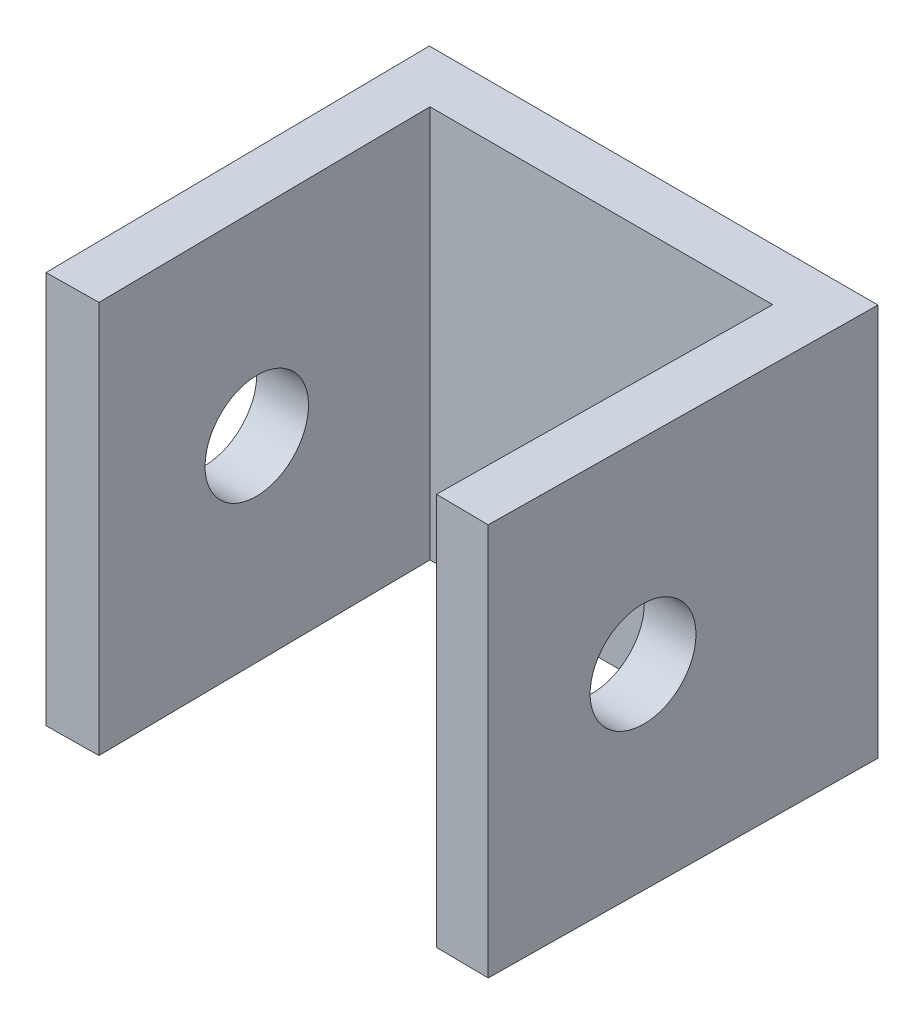
from build123d import *

# Parameters (mm, degrees)
BOSS_EXTRUDE1_DEPTH      = 30
SKETCH3_R                = 4
CUT_EXTRUDE1_DEPTH       = 40
SKETCH4_W                = 3
SKETCH4_H                = 41
BOSS_EXTRUDE2_DEPTH      = 4
BOSS_EXTRUDE3_DEPTH      = 25
BOSS_EXTRUDE3_DEPTH_BACK = 4
SKETCH5_W                = 3
SKETCH5_H                = 7.75
BOSS_EXTRUDE4_REACH      = 69.734
SKETCH6_W                = 4
SKETCH6_H                = 56.5
CUT_EXTRUDE2_DEPTH       = 62


with BuildPart() as part:
    # Sketch1 → Boss-Extrude1 (new body)
    with BuildSketch(Plane(origin=(0, 0, 0), x_dir=(1, 0, 0), z_dir=(0, 1, 0))):
        Polygon((-12.8, -12.8), (-13.1, 12.8), (13.1, 12.8), (12.8, -12.6), (16.799721029, -12.6472408), (17.147523085, 16.8), (-17.147149649, 16.8), (-16.79972537, -12.846871782), align=None)
    extrude(amount=BOSS_EXTRUDE1_DEPTH)

    # Sketch3 → Cut-Extrude1 (cut)
    with BuildSketch(Plane(origin=(16.946733814, 0, 0.200158273), x_dir=(0.011810199887684227, 0, -0.9999302571572745), z_dir=(0.9999302571572745, 0, 0.011810199887684227))):
        with Locations(Location((-0.747950682, 15, 0), (0, 0, 180))):
            Circle(SKETCH3_R)
    extrude(amount=-CUT_EXTRUDE1_DEPTH, mode=Mode.SUBTRACT)

    # Sketch4 → Boss-Extrude2 (add)
    with BuildSketch(Plane(origin=(0, 0, -16.8), x_dir=(-1, 0, 0), z_dir=(0, 0, -1))):
        with Locations((12.499813282, 15)):
            Rectangle(SKETCH4_W, SKETCH4_H)
    extrude(amount=-BOSS_EXTRUDE2_DEPTH)

    # Sketch5 → Boss-Extrude3 (add, two sides: drawn at the far end of the back side and taken through both)
    with BuildSketch(Plane(origin=(0, 0, -16.8), x_dir=(-1, 0, 0), z_dir=(0, 0, -1)).offset(-BOSS_EXTRUDE3_DEPTH_BACK)):
        with Locations((12.499813282, 39.375)):
            Rectangle(SKETCH5_W, SKETCH5_H)
        with Locations((12.499813282, -9.375)):
            Rectangle(SKETCH5_W, SKETCH5_H)
    extrude(amount=BOSS_EXTRUDE3_DEPTH + BOSS_EXTRUDE3_DEPTH_BACK)

    # Boss-Extrude4: up to this plane
    boss_extrude4_end = Plane(origin=(-16.79972537, 30, 12.846871782), z_dir=(0.9999313425206403, 0, -0.01171794542016394))
    # Sketch6 → Boss-Extrude4 (add, up to the surface)
    with BuildSketch(Plane.ZY.offset(13.999813282), mode=Mode.PRIVATE) as boss_extrude4_sk1:
        with Locations((-14.8, 15)):
            Rectangle(SKETCH6_W, SKETCH6_H)
    boss_extrude4_tool1 = split(extrude(boss_extrude4_sk1.sketch, amount=BOSS_EXTRUDE4_REACH, mode=Mode.PRIVATE), bisect_by=boss_extrude4_end, keep=Keep.BOTH, mode=Mode.PRIVATE)
    add(boss_extrude4_tool1.solids().sort_by_distance((-13.999813, 15, -14.8))[0])

    # Sketch7 → Cut-Extrude2 (cut)
    with BuildSketch(Plane(origin=(-16.947947202, 0, 0.198608756), x_dir=(0.01171794542016394, 0, 0.9999313425206403), z_dir=(-0.9999313425206403, 0, 0.01171794542016394))):
        Polygon((12.649131483, 30), (-40.255802642, 30), (-53.566220107, 38.891145172), (-52.192714639, 50.02792354), (-13.80333558, 48.779139174), (23.506142402, 46.053591691), (14.671560105, 30), align=None)
        Polygon((12.649131483, 0), (-49.960950266, 0), (-43.210741963, -24.331655391), (11.653429031, -25.806337238), (35.291011187, -15.934393486), (29.689158759, -2.52120452), align=None)
    extrude(amount=-CUT_EXTRUDE2_DEPTH, mode=Mode.SUBTRACT)


solid = part.part
